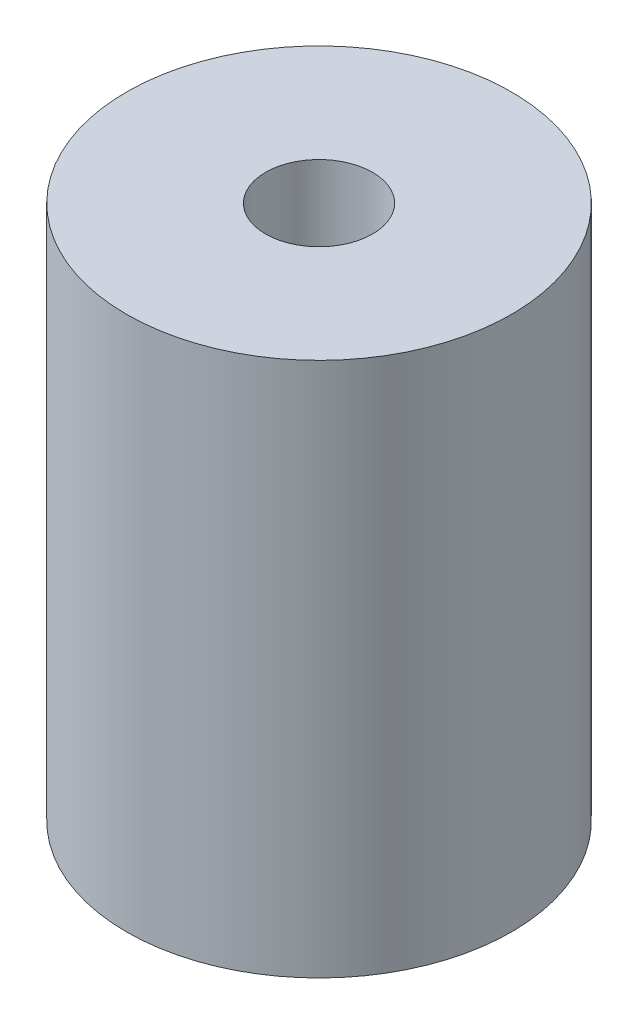
from build123d import *

# Parameters (mm, degrees)
SKETCH1_R           = 9
SKETCH1_R_2         = 2.5
BOSS_EXTRUDE1_DEPTH = 25
SKETCH2_R           = 4
CUT_EXTRUDE1_DEPTH  = 10


with BuildPart() as part:
    # Sketch1 → Boss-Extrude1 (new body)
    with BuildSketch(Plane(origin=(0, 0, 0), x_dir=(1, 0, 0), z_dir=(0, 1, 0))):
        with Locations(Location((0, 0, 0), (0, 0, 270))):
            Circle(SKETCH1_R)
        with Locations(Location((0, 0, 0), (0, 0, 270))):
            Circle(SKETCH1_R_2, mode=Mode.SUBTRACT)
    extrude(amount=BOSS_EXTRUDE1_DEPTH)

    # Sketch2 → Cut-Extrude1 (cut)
    with BuildSketch(Plane.XZ):
        with Locations(Location((0, 0, 0), (0, 0, 270))):
            Circle(SKETCH2_R)
    extrude(amount=-CUT_EXTRUDE1_DEPTH, mode=Mode.SUBTRACT)


solid = part.part
